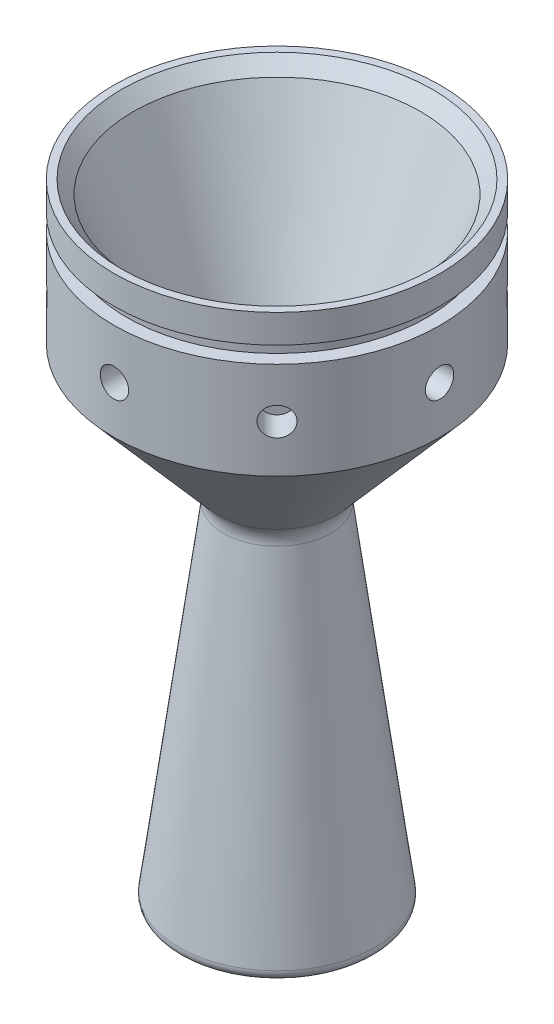
from build123d import *

# Parameters (mm, degrees)
FILETE4_R             = 5
FILETE5_R             = 2
FILETE6_R             = 2
ESBO_O2_R             = 3
CORTE_EXTRUS_O1_DEPTH = 6
PADR_OCIRCULAR1_COUNT = 8
CHANFRO3_SIZE         = 3
CHANFRO3_SIZE2        = 1.391688553


with BuildPart() as part:
    # Esboço1 → Revolução1 (revolve)
    with BuildSketch(Plane.XY, mode=Mode.PRIVATE) as revolu_o1_sk:
        Polygon((-13.688060187, 0), (-16.688060187, 0), (-16.688060187, -6), (-13.888060187, -6), (-13.888060187, -9.5), (-16.688060187, -9.5), (-16.688060187, -30), (6.757041151, -56.954385068), (-3.162394771, -132.299981266), (-0.188060187, -132.691559843), (9.811939813, -56.734018716), align=None)
    revolve(revolu_o1_sk.sketch.rotate(Axis((17.811939813, -4.773902368, 0), (0, 1, 0)), 270), axis=Axis((17.811939813, -4.773902368, 0), (0, 1, 0)))

    # Filete4
    filete4_edges = [part.edges().sort_by_distance(p)[0] for p in [
        (17.811939813, -56.954385068, 11.054898662),
    ]]
    fillet(filete4_edges, radius=FILETE4_R)

    # Filete5
    filete5_edges = [part.edges().sort_by_distance(p)[0] for p in [
        (17.811939813, -132.299981266, 20.974334584),
    ]]
    fillet(filete5_edges, radius=FILETE5_R)

    # Filete6
    filete6_edges = [part.edges().sort_by_distance(p)[0] for p in [
        (17.811939813, -56.734018716, 8),
    ]]
    fillet(filete6_edges, radius=FILETE6_R)

    # Esboço2 → Corte-extrusão1 (cut)
    with BuildSketch(Plane.XY.offset(-34.5)):
        with Locations(Location((17.811939813, -20, 0), (0, 0, 270))):
            Circle(ESBO_O2_R)
    corte_extrus_o1 = extrude(amount=CORTE_EXTRUS_O1_DEPTH, mode=Mode.SUBTRACT)

    # PadrãoCircular1: Corte-extrusão1 ×8 about axis
    padr_ocircular1_axis = Axis((17.811939813, 0, 0), (0, 1, 0))
    for i in range(1, PADR_OCIRCULAR1_COUNT):
        add(corte_extrus_o1.rotate(padr_ocircular1_axis, i * 360 / PADR_OCIRCULAR1_COUNT), mode=Mode.SUBTRACT)

    # Chanfro3
    chanfro3_edges = [part.edges().sort_by_distance(p)[0] for p in [
        (17.811939813, 0, 31.5),
    ]]
    chanfro3_side = [part.faces().sort_by_distance(p)[0] for p in [
        (17.811939813, -28.119456583, 19.852539717),
    ]]
    chamfer(chanfro3_edges, length=CHANFRO3_SIZE, length2=CHANFRO3_SIZE2, reference=chanfro3_side[0])


solid = part.part
